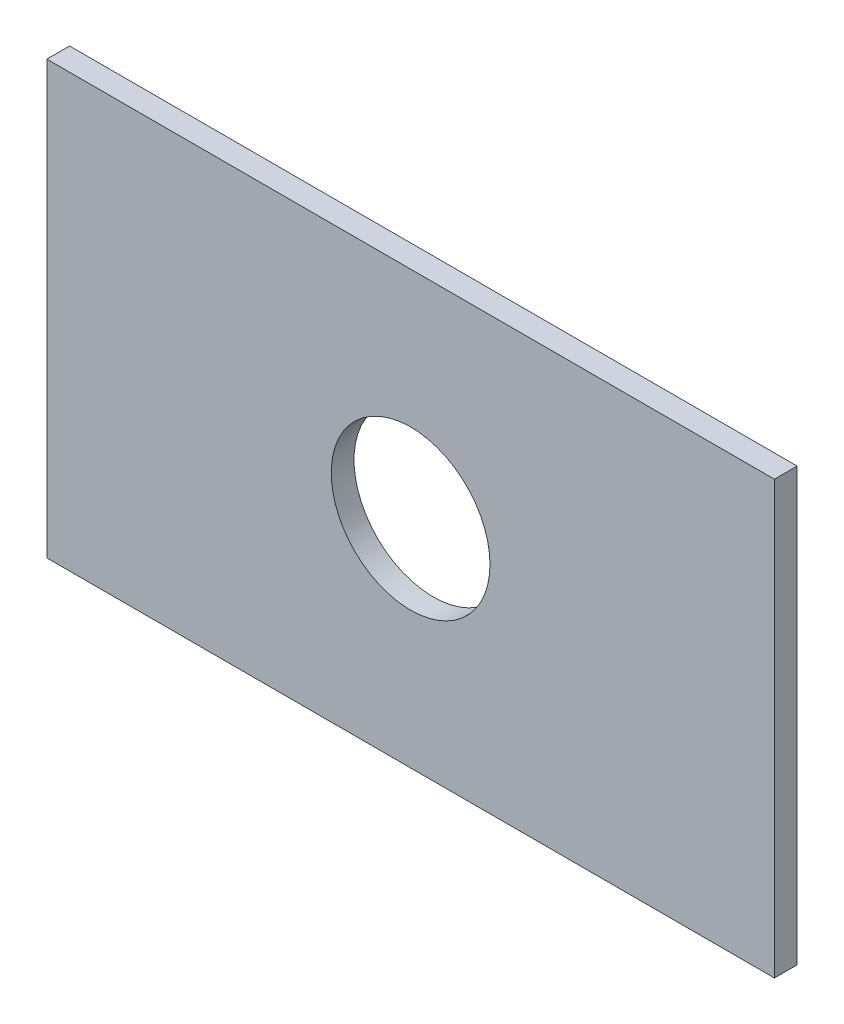
from build123d import *

# Parameters (mm, degrees)
BLOCKBASE_W        = 203.2
BLOCKBASE_H        = 120.65
BLOCK_DEPTH        = 6.35
SKETCH1_R          = 22.165931145
CUT_EXTRUDE1_DEPTH = 119.329996725


with BuildPart() as part:
    # BlockBase → Block (new body)
    with BuildSketch(Plane.XY):
        Rectangle(BLOCKBASE_W, BLOCKBASE_H)
    extrude(amount=BLOCK_DEPTH)

    # Sketch1 → Cut-Extrude1 (cut, through all)
    with BuildSketch(Plane.XY.offset(6.35)):
        Circle(SKETCH1_R)
    extrude(amount=-CUT_EXTRUDE1_DEPTH, mode=Mode.SUBTRACT)


solid = part.part
